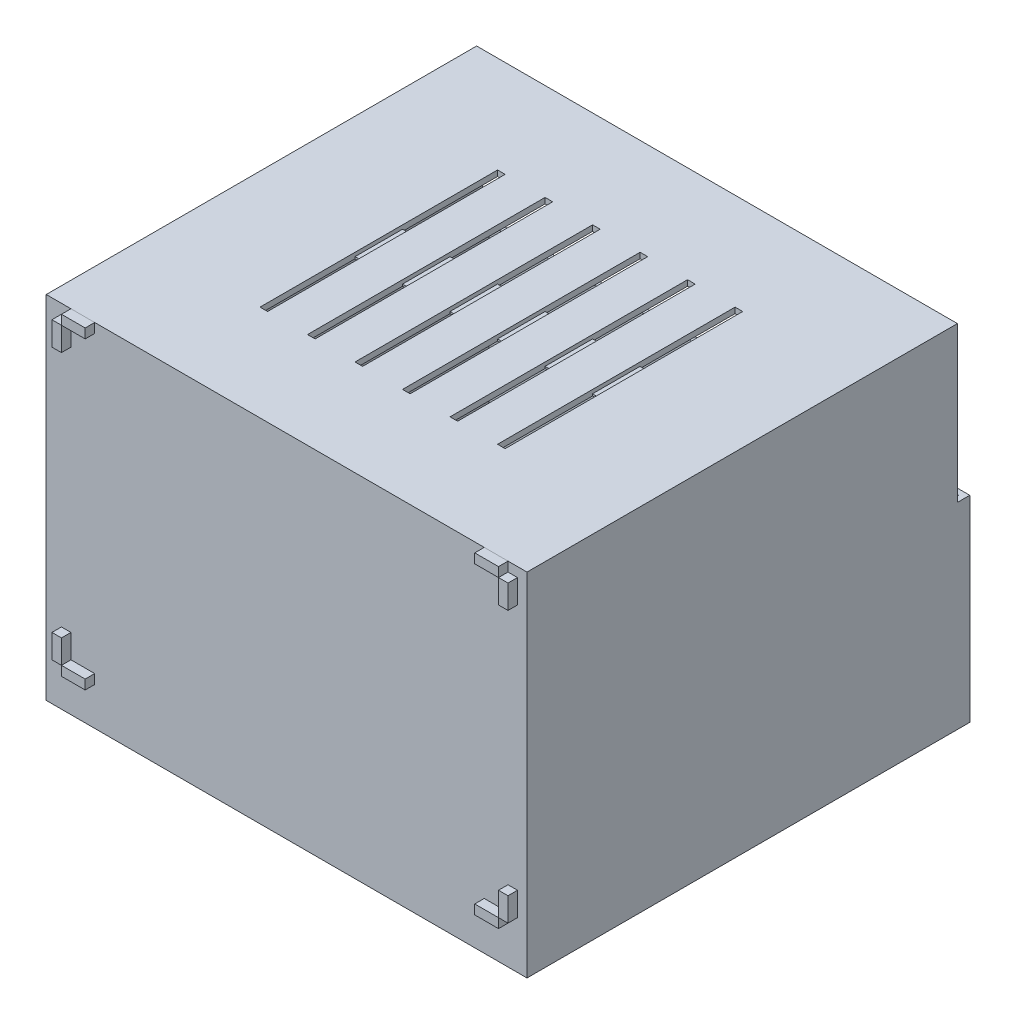
from build123d import *

# Parameters (mm, degrees)
SKETCH1_W             = 92
SKETCH1_H             = 62
BOSS_EXTRUDE1_DEPTH   = 2
SKETCH2_W             = 5
SKETCH2_H             = 2
BOSS_EXTRUDE6_DEPTH   = 2
SKETCH2_W_2           = 2
SKETCH2_H_2           = 62
BOSS_EXTRUDE6_2_DEPTH = 2
BOSS_EXTRUDE6_3_DEPTH = 2
BOSS_EXTRUDE6_4_DEPTH = 2
BOSS_EXTRUDE6_5_DEPTH = 2
BOSS_EXTRUDE6_6_DEPTH = 2
SKETCH4_W             = 100
SKETCH4_H             = 74
BOSS_EXTRUDE11_DEPTH  = 2
SKETCH5_W             = 100
SKETCH5_H             = 1.2
BOSS_EXTRUDE12_DEPTH  = 90
SKETCH6_W             = 92
SKETCH6_H             = 74
BOSS_EXTRUDE13_DEPTH  = 1.2
SKETCH8_W             = 101.2
SKETCH8_H             = 74
BOSS_EXTRUDE14_DEPTH  = 1.2
SKETCH10_W            = 1.6
SKETCH10_H            = 50
CUT_EXTRUDE1_DEPTH    = 105
SKETCH11_W            = 1.6
SKETCH11_H            = 20
CUT_EXTRUDE2_DEPTH    = 10
SKETCH12_W            = 1.6
SKETCH12_H            = 10
CUT_EXTRUDE3_DEPTH    = 0.8
SKETCH14_W            = 2
SKETCH14_H            = 52
CUT_EXTRUDE4_DEPTH    = 2
SKETCH15_W            = 91.2
SKETCH15_H            = 2.6
CUT_EXTRUDE5_DEPTH    = 0.8
SKETCH16_W            = 98.8
SKETCH16_H            = 1.2
CUT_EXTRUDE7_DEPTH    = 32.6
SKETCH17_W            = 8
SKETCH17_H            = 55
BOSS_EXTRUDE15_DEPTH  = 2
SKETCH20_W            = 88.6
SKETCH20_H            = 1.2
BOSS_EXTRUDE16_DEPTH  = 98.8
SKETCH21_W            = 1.2
SKETCH21_H            = 2.6
CUT_EXTRUDE8_DEPTH    = 32.6


with BuildPart() as part:
    # Sketch1 → Boss-Extrude1 (new body)
    with BuildSketch(Plane.XY):
        with Locations((36.992766712, -31.029822375)):
            Rectangle(SKETCH1_W, SKETCH1_H)
    extrude(amount=BOSS_EXTRUDE1_DEPTH)

    # Sketch4 → Boss-Extrude11 (add)
    with BuildSketch(Plane.XY.offset(2)):
        with Locations((36.992766712, -35.029822375)):
            Rectangle(SKETCH4_W, SKETCH4_H)
    extrude(amount=-BOSS_EXTRUDE11_DEPTH)

    # Sketch5 → Boss-Extrude12 (add)
    with BuildSketch(Plane(origin=(0, 0, 0), x_dir=(-1, 0, 0), z_dir=(0, 0, -1))):
        with Locations((-36.992766712, -71.429822375)):
            Rectangle(SKETCH5_W, SKETCH5_H)
    extrude(amount=BOSS_EXTRUDE12_DEPTH)

    # Sketch6 → Boss-Extrude13 (add)
    with BuildSketch(Plane.ZY.offset(13.007233288)):
        with Locations((-44, -35.029822375)):
            Rectangle(SKETCH6_W, SKETCH6_H)
    boss_extrude13 = extrude(amount=BOSS_EXTRUDE13_DEPTH)

    # Mirror1: Boss-Extrude13 across plane
    add(boss_extrude13.mirror(Plane(origin=(36.392766712, 0, 0), x_dir=(0, 0, 1), z_dir=(1, 0, 0))))

    # Sketch8 → Boss-Extrude14 (add)
    with BuildSketch(Plane(origin=(0, 0, -90), x_dir=(-1, 0, 0), z_dir=(0, 0, -1))):
        with Locations((-36.392766712, -35.029822375)):
            Rectangle(SKETCH8_W, SKETCH8_H)
    extrude(amount=BOSS_EXTRUDE14_DEPTH)

    # Sketch10 → Cut-Extrude1 (cut)
    with BuildSketch(Plane.XZ.offset(72.029822375)):
        with Locations((6.392766712, -43.2)):
            Rectangle(SKETCH10_W, SKETCH10_H)
        with Locations((16.392766712, -43.2)):
            Rectangle(SKETCH10_W, SKETCH10_H)
        with Locations((26.392766712, -43.2)):
            Rectangle(SKETCH10_W, SKETCH10_H)
        with Locations((36.392766712, -43.2)):
            Rectangle(SKETCH10_W, SKETCH10_H)
        with Locations((46.392766712, -43.2)):
            Rectangle(SKETCH10_W, SKETCH10_H)
        with Locations((56.392766712, -43.2)):
            Rectangle(SKETCH10_W, SKETCH10_H)
        with Locations((66.392766712, -43.2)):
            Rectangle(SKETCH10_W, SKETCH10_H)
    extrude(amount=-CUT_EXTRUDE1_DEPTH, mode=Mode.SUBTRACT)

    # Sketch11 → Cut-Extrude2 (cut)
    with BuildSketch(Plane.XZ.offset(72.029822375)):
        with Locations((61.392766712, -28.2)):
            Rectangle(SKETCH11_W, SKETCH11_H)
        with Locations((51.392766712, -28.2)):
            Rectangle(SKETCH11_W, SKETCH11_H)
        with Locations((41.392766712, -28.2)):
            Rectangle(SKETCH11_W, SKETCH11_H)
        with Locations((31.392766712, -28.2)):
            Rectangle(SKETCH11_W, SKETCH11_H)
        with Locations((21.392766712, -28.2)):
            Rectangle(SKETCH11_W, SKETCH11_H)
        with Locations((11.392766712, -28.2)):
            Rectangle(SKETCH11_W, SKETCH11_H)
        with Locations((51.392766712, -58.2)):
            Rectangle(SKETCH11_W, SKETCH11_H)
        with Locations((41.392766712, -58.2)):
            Rectangle(SKETCH11_W, SKETCH11_H)
        with Locations((31.392766712, -58.2)):
            Rectangle(SKETCH11_W, SKETCH11_H)
        with Locations((21.392766712, -58.2)):
            Rectangle(SKETCH11_W, SKETCH11_H)
        with Locations((11.392766712, -58.2)):
            Rectangle(SKETCH11_W, SKETCH11_H)
        with Locations((61.392766712, -58.2)):
            Rectangle(SKETCH11_W, SKETCH11_H)
    cut_extrude2 = extrude(amount=-CUT_EXTRUDE2_DEPTH, mode=Mode.SUBTRACT)

    # Sketch12 → Cut-Extrude3 (cut)
    with BuildSketch(Plane.XZ.offset(72.029822375)):
        with Locations((61.392766712, -43.2)):
            Rectangle(SKETCH12_W, SKETCH12_H)
        with Locations((41.392766712, -43.2)):
            Rectangle(SKETCH12_W, SKETCH12_H)
        with Locations((11.392766712, -43.2)):
            Rectangle(SKETCH12_W, SKETCH12_H)
        with Locations((51.392766712, -43.2)):
            Rectangle(SKETCH12_W, SKETCH12_H)
        with Locations((31.392766712, -43.2)):
            Rectangle(SKETCH12_W, SKETCH12_H)
        with Locations((21.392766712, -43.2)):
            Rectangle(SKETCH12_W, SKETCH12_H)
    cut_extrude3 = extrude(amount=-CUT_EXTRUDE3_DEPTH, mode=Mode.SUBTRACT)

    # Sketch15 → Cut-Extrude5 (cut)
    with BuildSketch(Plane(origin=(-13.007233288, 0, 0), x_dir=(0, 0, -1), z_dir=(1, 0, 0))):
        with Locations((45.6, -29.329822375)):
            Rectangle(SKETCH15_W, SKETCH15_H)
    cut_extrude5 = extrude(amount=-CUT_EXTRUDE5_DEPTH, mode=Mode.SUBTRACT)

    # Mirror2: Cut-Extrude5 across plane
    add(cut_extrude5.mirror(Plane(origin=(36.392766712, 0, 0), x_dir=(0, 0, 1), z_dir=(1, 0, 0))), mode=Mode.SUBTRACT)

    # Sketch16 → Cut-Extrude7 (cut)
    with BuildSketch(Plane(origin=(0, 1.970177625, 0), x_dir=(1, 0, 0), z_dir=(0, 1, 0))):
        with Locations((36.392766712, 90.6)):
            Rectangle(SKETCH16_W, SKETCH16_H)
    extrude(amount=-CUT_EXTRUDE7_DEPTH, mode=Mode.SUBTRACT)

    # Sketch17 → Boss-Extrude15 (add)
    with BuildSketch(Plane.XZ.offset(72.029822375)):
        with Locations((-3.207233288, -43.5)):
            Rectangle(SKETCH17_W, SKETCH17_H)
    boss_extrude15 = extrude(amount=BOSS_EXTRUDE15_DEPTH)

    # Mirror3: Boss-Extrude15 across plane
    add(boss_extrude15.mirror(Plane(origin=(36.392766712, 0, 0), x_dir=(0, 0, 1), z_dir=(1, 0, 0))))

    # Sketch20 → Boss-Extrude16 (add)
    with BuildSketch(Plane.ZY.offset(-85.792766712)):
        with Locations((-44.3, 1.370177625)):
            Rectangle(SKETCH20_W, SKETCH20_H)
    extrude(amount=BOSS_EXTRUDE16_DEPTH)

    # Sketch21 → Cut-Extrude8 (cut)
    with BuildSketch(Plane(origin=(0, 1.970177625, 0), x_dir=(1, 0, 0), z_dir=(0, 1, 0))):
        with Locations((-13.607233288, 89.9)):
            Rectangle(SKETCH21_W, SKETCH21_H)
        with Locations((86.392766712, 89.9)):
            Rectangle(SKETCH21_W, SKETCH21_H)
    extrude(amount=-CUT_EXTRUDE8_DEPTH, mode=Mode.SUBTRACT)

    # Mirror4: Cut-Extrude2 across plane
    add(cut_extrude2.mirror(Plane.ZX.offset(-35.029822375)), mode=Mode.SUBTRACT)

    # Mirror5: Cut-Extrude3 across plane
    add(cut_extrude3.mirror(Plane.ZX.offset(-35.029822375)), mode=Mode.SUBTRACT)


with BuildPart() as body_2:
    # Sketch2 → Boss-Extrude6 (new body)
    with BuildSketch(Plane.XY.offset(2)):
        with Locations((-6.507233288, 0.970177625)):
            Rectangle(SKETCH2_W, SKETCH2_H)
    extrude(amount=BOSS_EXTRUDE6_DEPTH)


with BuildPart() as body_3:
    # Sketch2 → Boss-Extrude6 2 (new body)
    with BuildSketch(Plane.XY.offset(2)):
        with Locations((-10.007233288, -31.029822375)):
            Rectangle(SKETCH2_W_2, SKETCH2_H_2)
    extrude(amount=BOSS_EXTRUDE6_2_DEPTH)


with BuildPart() as body_4:
    # Sketch2 → Boss-Extrude6 3 (new body)
    with BuildSketch(Plane.XY.offset(2)):
        with Locations((80.492766712, 0.970177625)):
            Rectangle(SKETCH2_W, SKETCH2_H)
    extrude(amount=BOSS_EXTRUDE6_3_DEPTH)


with BuildPart() as body_5:
    # Sketch2 → Boss-Extrude6 4 (new body)
    with BuildSketch(Plane.XY.offset(2)):
        with Locations((83.992766712, -31.029822375)):
            Rectangle(SKETCH2_W_2, SKETCH2_H_2)
    extrude(amount=BOSS_EXTRUDE6_4_DEPTH)


with BuildPart() as body_6:
    # Sketch2 → Boss-Extrude6 5 (new body)
    with BuildSketch(Plane.XY.offset(2)):
        with Locations((80.492766712, -63.029822375)):
            Rectangle(SKETCH2_W, SKETCH2_H)
    extrude(amount=BOSS_EXTRUDE6_5_DEPTH)


with BuildPart() as body_7:
    # Sketch2 → Boss-Extrude6 6 (new body)
    with BuildSketch(Plane.XY.offset(2)):
        with Locations((-6.507233288, -63.029822375)):
            Rectangle(SKETCH2_W, SKETCH2_H)
    extrude(amount=BOSS_EXTRUDE6_6_DEPTH)


with BuildPart() as cut_extrude4_tool:
    # Sketch14 → Cut-Extrude4 (new body)
    with BuildSketch(Plane.XY.offset(4)):
        with Locations((-10.007233288, -31.029822375)):
            Rectangle(SKETCH14_W, SKETCH14_H)
        with Locations((83.992766712, -31.029822375)):
            Rectangle(SKETCH14_W, SKETCH14_H)
    extrude(amount=-CUT_EXTRUDE4_DEPTH)


with BuildPart() as body_3_1:
    add(body_3.part)

    # Cut-Extrude4: cut by cut_extrude4_tool
    add(cut_extrude4_tool.part, mode=Mode.SUBTRACT)


with BuildPart() as body_5_1:
    add(body_5.part)

    # Cut-Extrude4: cut by cut_extrude4_tool
    add(cut_extrude4_tool.part, mode=Mode.SUBTRACT)


with BuildPart() as cut_extrude4_piece_1:
    # of the separate pieces the step leaves, piece 1, a body of its own (cut_extrude4_pieces)
    add(body_3_1.part.solids().sort_by_distance((-11.007233288, -0.029822375, 2))[0])


with BuildPart() as cut_extrude4_piece_2:
    # of the separate pieces the step leaves, piece 2, a body of its own (cut_extrude4_pieces)
    add(body_3_1.part.solids().sort_by_distance((-11.007233288, -57.029822375, 2))[0])


with BuildPart() as cut_extrude4_piece_1_of_body_5:
    # of the separate pieces the step leaves, piece 1, a body of its own (cut_extrude4_pieces_of_body_5)
    add(body_5_1.part.solids().sort_by_distance((84.992766712, -57.029822375, 2))[0])


with BuildPart() as cut_extrude4_piece_2_of_body_5:
    # of the separate pieces the step leaves, piece 2, a body of its own (cut_extrude4_pieces_of_body_5)
    add(body_5_1.part.solids().sort_by_distance((84.992766712, -0.029822375, 2))[0])


solid = Compound([part.part, body_2.part, body_4.part, body_6.part, body_7.part, cut_extrude4_piece_1.part, cut_extrude4_piece_2.part, cut_extrude4_piece_1_of_body_5.part, cut_extrude4_piece_2_of_body_5.part])
